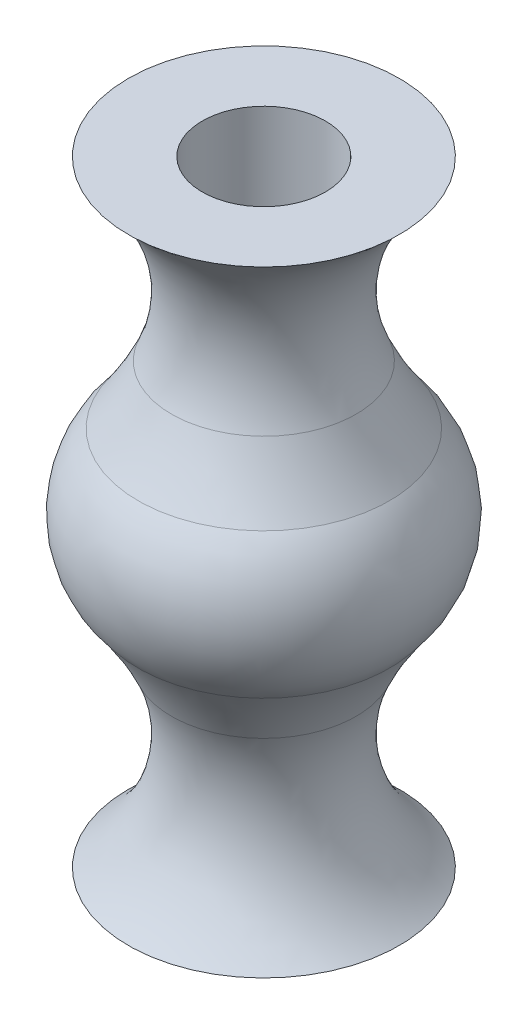
from build123d import *

# Parameters (mm, degrees)
ESQUISSE5_R             = 1
ENL_V_MAT_EXTRU_2_DEPTH = 10


with BuildPart() as part:
    # Esquisse1 → Révolution2 (revolve)
    with BuildSketch(Plane.XY):
        with BuildLine():
            Line((0, 5), (0, -5))
            Line((0, -5), (-2.2, -5))
            ThreePointArc((-2.2, -5), (-1.357495617, -3.68245461), (-1.5, -2.125074762))
            ThreePointArc((-1.5, -2.125074762), (-1.747791972, -1.637919756), (-2.042253504, -1.177470772))
            ThreePointArc((-2.042253504, -1.177470772), (-2.5, 0), (-2.042253504, 1.177470772))
            ThreePointArc((-2.042253504, 1.177470772), (-1.747791972, 1.637919756), (-1.5, 2.125074762))
            ThreePointArc((-1.5, 2.125074762), (-1.357495617, 3.68245461), (-2.2, 5))
            Line((-2.2, 5), (0, 5))
        make_face()
    revolve(axis=Axis((0, -2, 0), (0, -1, 0)))

    # Esquisse5 → Enlèv. mat.-Extru.2 (cut)
    with BuildSketch(Plane(origin=(0, -5, 0), x_dir=(-1, 0, 0), z_dir=(0, -1, 0))):
        with Locations(Location((0, 0, 0), (0, 0, 180))):
            Circle(ESQUISSE5_R)
    extrude(amount=-ENL_V_MAT_EXTRU_2_DEPTH, mode=Mode.SUBTRACT)


solid = part.part
